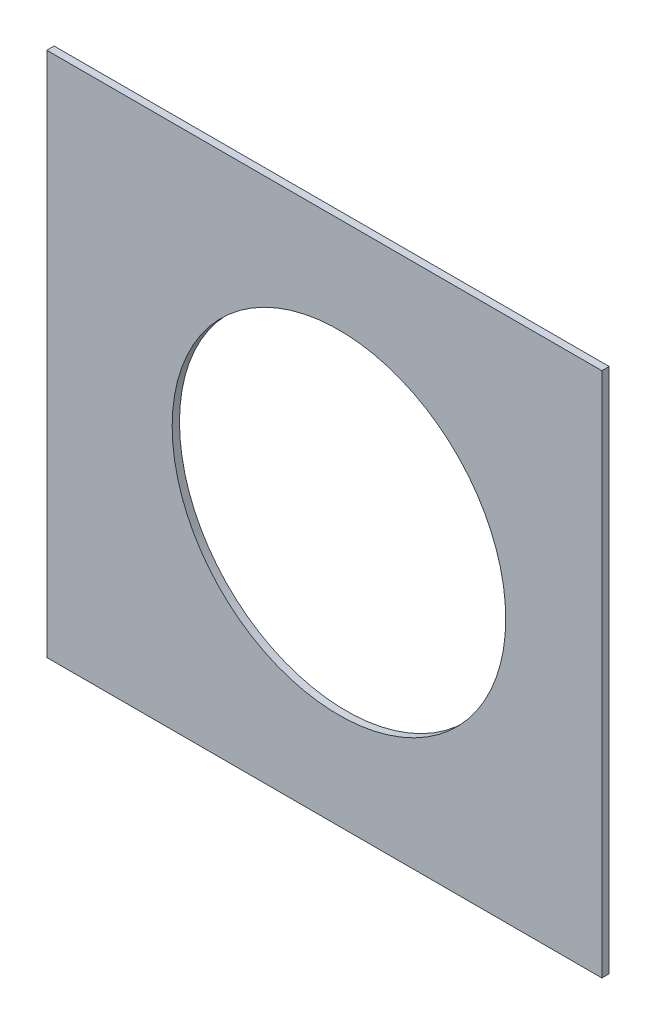
from build123d import *

# Parameters (mm, degrees)
SKETCH2_W           = 241.3
SKETCH2_H           = 228.6
SKETCH2_R           = 100
SKETCH2_R_2         = 72.5
BOSS_EXTRUDE1_DEPTH = 3.175


with BuildPart() as part:
    # Sketch2 → Boss-Extrude1 (new body)
    # profile 1 of 2: a face of its own
    with BuildSketch(Plane.XY):
        with Locations((-6.35, 0)):
            Rectangle(SKETCH2_W, SKETCH2_H)
        Circle(SKETCH2_R, mode=Mode.SUBTRACT)
    # profile 2 of 2: a face of its own
    with BuildSketch(Plane.XY):
        Circle(SKETCH2_R)
        Circle(SKETCH2_R_2, mode=Mode.SUBTRACT)
    extrude(amount=BOSS_EXTRUDE1_DEPTH)


solid = part.part
